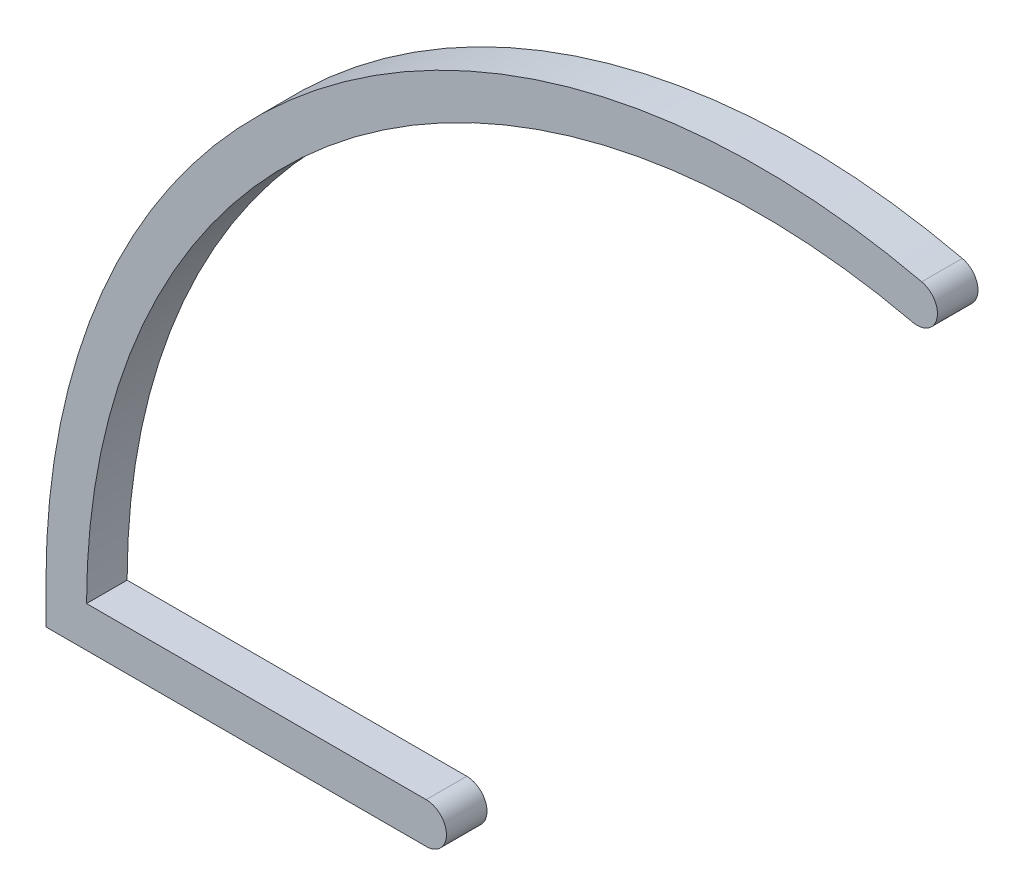
from build123d import *

# Parameters (mm, degrees)
BOSS_EXTRUDE1_DEPTH = 5


with BuildPart() as part:
    # Sketch1 → Boss-Extrude1 (new, symmetric)
    with BuildSketch(Plane.XY):
        with BuildLine():
            Line((552.821544179, 848.961112624), (459.088326812, 848.961112624))
            Line((459.088326812, 848.961112624), (459.088326812, 858.961112624))
            ThreePointArc((459.088326812, 858.961112624), (525.634918269, 996.884166681), (675.00895728, 1030.627523725))
            ThreePointArc((675.00895728, 1030.627523725), (678.753172827, 1024.629119776), (672.754768877, 1020.884904229))
            ThreePointArc((672.754768877, 1020.884904229), (531.858185738, 989.056590938), (469.088326812, 858.961112624))
            Line((469.088326812, 858.961112624), (552.821544179, 858.961112624))
            ThreePointArc((552.821544179, 858.961112624), (557.821544179, 853.961112624), (552.821544179, 848.961112624))
        make_face()
    extrude(amount=BOSS_EXTRUDE1_DEPTH, both=True)


solid = part.part
